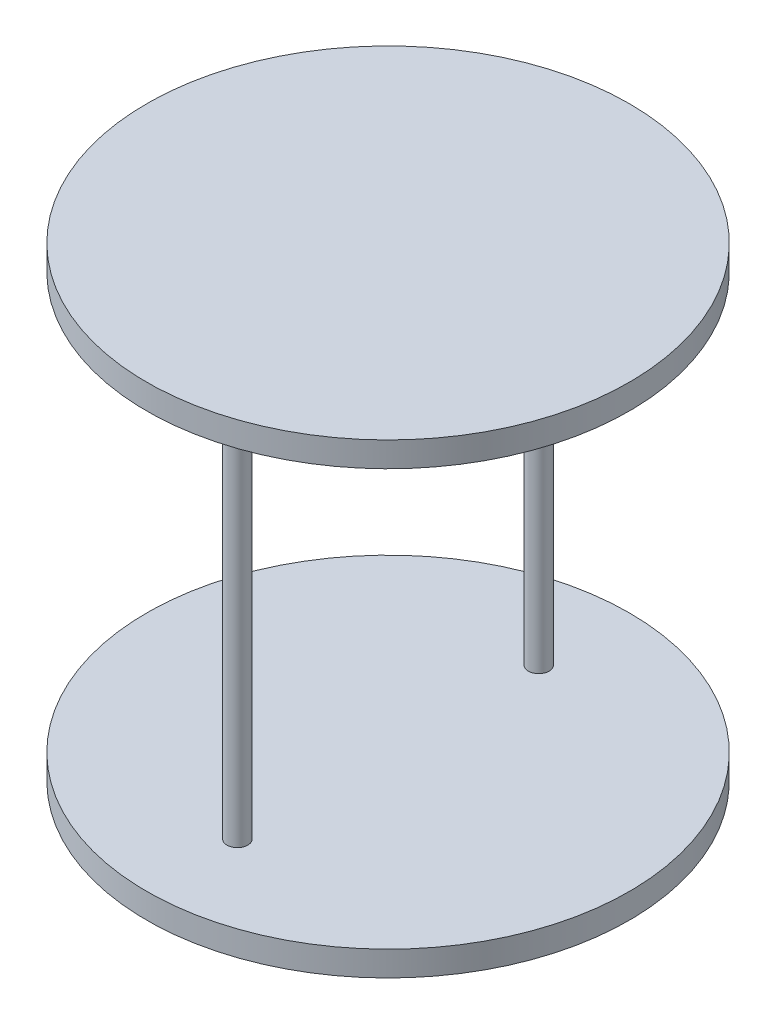
from build123d import *

# Parameters (mm, degrees)
SKETCH1_R           = 73.66
BOSS_EXTRUDE1_DEPTH = 7.62
SKETCH2_R           = 3.175
BOSS_EXTRUDE2_DEPTH = 63.5
SKETCH3_R           = 73.66
BOSS_EXTRUDE3_DEPTH = 7.62


with BuildPart() as part:
    # Sketch1 → Boss-Extrude1 (new body)
    with BuildSketch(Plane(origin=(0, 0, 0), x_dir=(1, 0, 0), z_dir=(0, 1, 0))):
        with Locations(Location((0, 0, 0), (0, 0, 90))):
            Circle(SKETCH1_R)
    extrude(amount=BOSS_EXTRUDE1_DEPTH)

    # Sketch2 → Boss-Extrude2 (add)
    with BuildSketch(Plane(origin=(0, 7.62, 0), x_dir=(1, 0, 0), z_dir=(0, 1, 0))):
        with Locations(Location((0, 46, 0), (0, 0, 270))):
            Circle(SKETCH2_R)
        with Locations(Location((0, -46, 0), (0, 0, 270))):
            Circle(SKETCH2_R)
    boss_extrude2 = extrude(amount=BOSS_EXTRUDE2_DEPTH)

    # Mirror1: Boss-Extrude2 across plane
    add(boss_extrude2.mirror(Plane.ZX.offset(71.12)))

    # Sketch3 → Boss-Extrude3 (add)
    with BuildSketch(Plane(origin=(0, 134.62, 0), x_dir=(1, 0, 0), z_dir=(0, 1, 0))):
        with Locations(Location((0, 0, 0), (0, 0, 90))):
            Circle(SKETCH3_R)
    extrude(amount=BOSS_EXTRUDE3_DEPTH)


solid = part.part
